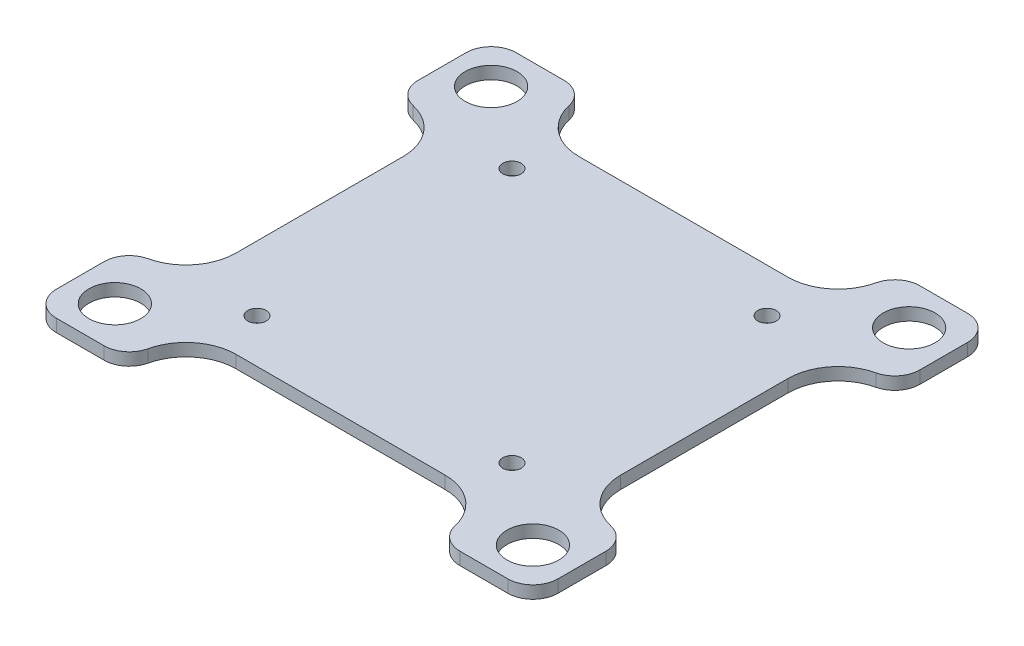
from build123d import *

# Parameters (mm, degrees)
SKETCH1_W           = 60
SKETCH1_H           = 55
BOSS_EXTRUDE1_DEPTH = 1.5
SKETCH2_R           = 3.1
CUT_EXTRUDE1_DEPTH  = 41.724685389
FILLET1_R           = 3
SKETCH4_W           = 37
SKETCH4_H           = 7
SKETCH4_W_2         = 7
SKETCH4_H_2         = 32
CUT_EXTRUDE2_DEPTH  = 41.724685389
FILLET2_R           = 6
FILLET3_R           = 3
SKETCH5_R           = 1.1
CUT_EXTRUDE3_DEPTH  = 41.724685533


with BuildPart() as part:
    # Sketch1 → Boss-Extrude1 (new body)
    with BuildSketch(Plane(origin=(0, 0, 0), x_dir=(1, 0, 0), z_dir=(0, 1, 0))):
        Rectangle(SKETCH1_W, SKETCH1_H)
    extrude(amount=BOSS_EXTRUDE1_DEPTH)

    # Sketch2 → Cut-Extrude1 (cut, through all)
    with BuildSketch(Plane(origin=(0, 1.5, 0), x_dir=(1, 0, 0), z_dir=(0, 1, 0))):
        with Locations(Location((-25, 22.5, 0), (0, 0, 270))):
            Circle(SKETCH2_R)
        with Locations(Location((25, 22.5, 0), (0, 0, 270))):
            Circle(SKETCH2_R)
        with Locations(Location((-25, -22.5, 0), (0, 0, 270))):
            Circle(SKETCH2_R)
        with Locations(Location((25, -22.5, 0), (0, 0, 270))):
            Circle(SKETCH2_R)
    extrude(amount=-CUT_EXTRUDE1_DEPTH, mode=Mode.SUBTRACT)

    # Fillet1
    fillet1_edges = [part.edges().sort_by_distance(p)[0] for p in [
        (-30, 0.75, -27.5),
        (30, 0.75, -27.5),
        (30, 0.75, 27.5),
        (-30, 0.75, 27.5),
    ]]
    fillet(fillet1_edges, radius=FILLET1_R)

    # Sketch4 → Cut-Extrude2 (cut, through all)
    with BuildSketch(Plane(origin=(0, 1.5, 0), x_dir=(1, 0, 0), z_dir=(0, 1, 0))):
        with Locations((0, 24)):
            Rectangle(SKETCH4_W, SKETCH4_H)
        with Locations((-26.5, 0)):
            Rectangle(SKETCH4_W_2, SKETCH4_H_2)
        with Locations((0, -24)):
            Rectangle(SKETCH4_W, SKETCH4_H)
        with Locations((26.5, 0)):
            Rectangle(SKETCH4_W_2, SKETCH4_H_2)
    extrude(amount=-CUT_EXTRUDE2_DEPTH, mode=Mode.SUBTRACT)

    # Fillet2
    fillet2_edges = [part.edges().sort_by_distance(p)[0] for p in [
        (-18.5, 0.75, -20.5),
        (18.5, 0.75, -20.5),
        (-23, 0.75, -16),
        (-23, 0.75, 16),
        (-18.5, 0.75, 20.5),
        (18.5, 0.75, 20.5),
        (23, 0.75, -16),
        (23, 0.75, 16),
    ]]
    fillet(fillet2_edges, radius=FILLET2_R)

    # Fillet3
    fillet3_edges = [part.edges().sort_by_distance(p)[0] for p in [
        (30, 0.75, -16),
        (18.5, 0.75, -27.5),
        (30, 0.75, 16),
        (18.5, 0.75, 27.5),
        (-18.5, 0.75, 27.5),
        (-30, 0.75, 16),
        (-18.5, 0.75, -27.5),
        (-30, 0.75, -16),
    ]]
    fillet(fillet3_edges, radius=FILLET3_R)

    # Sketch5 → Cut-Extrude3 (cut, through all)
    with BuildSketch(Plane(origin=(0, 1.5, 0), x_dir=(1, 0, 0), z_dir=(0, 1, 0))):
        with Locations(Location((-15.25, 15.25, 0), (0, 0, 270))):
            Circle(SKETCH5_R)
        with Locations(Location((15.25, 15.25, 0), (0, 0, 270))):
            Circle(SKETCH5_R)
        with Locations(Location((-15.25, -15.25, 0), (0, 0, 270))):
            Circle(SKETCH5_R)
        with Locations(Location((15.25, -15.25, 0), (0, 0, 270))):
            Circle(SKETCH5_R)
    extrude(amount=-CUT_EXTRUDE3_DEPTH, mode=Mode.SUBTRACT)


solid = part.part
